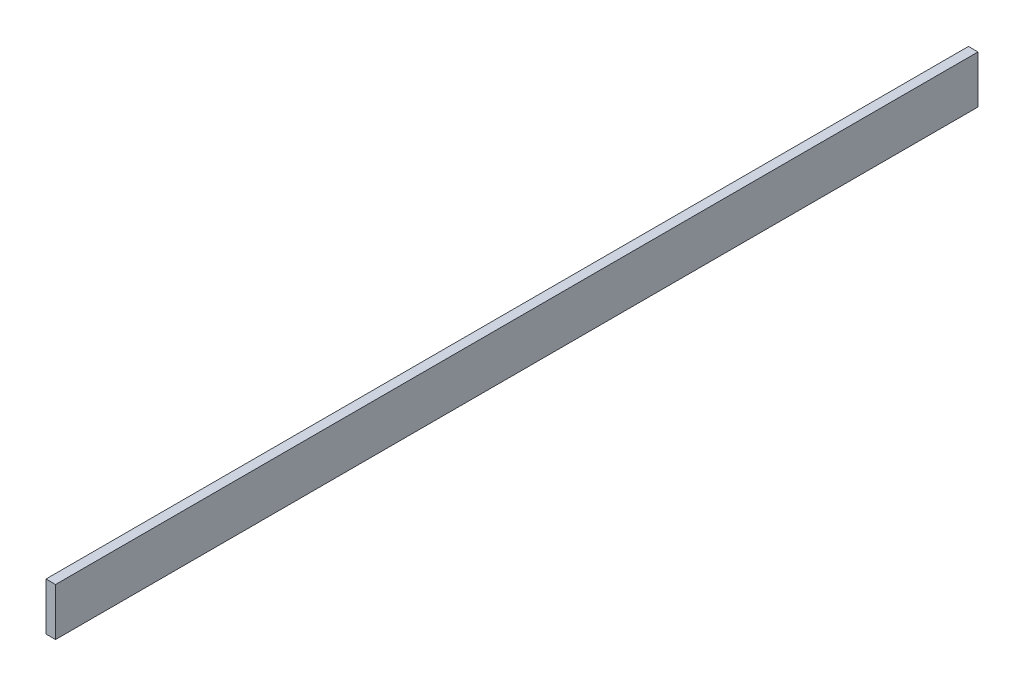
from build123d import *

# Parameters (mm, degrees)
IZIM1_W                     = 290
IZIM1_H                     = 15
Y_KSEKLIK_EKSTR_ZYON1_DEPTH = 3


with BuildPart() as part:
    # Çizim1 → Yükseklik-Ekstrüzyon1 (new body)
    with BuildSketch(Plane(origin=(0, 0, 0), x_dir=(0, 0, -1), z_dir=(1, 0, 0))):
        with Locations((145, 7.5)):
            Rectangle(IZIM1_W, IZIM1_H)
    extrude(amount=Y_KSEKLIK_EKSTR_ZYON1_DEPTH)


solid = part.part
